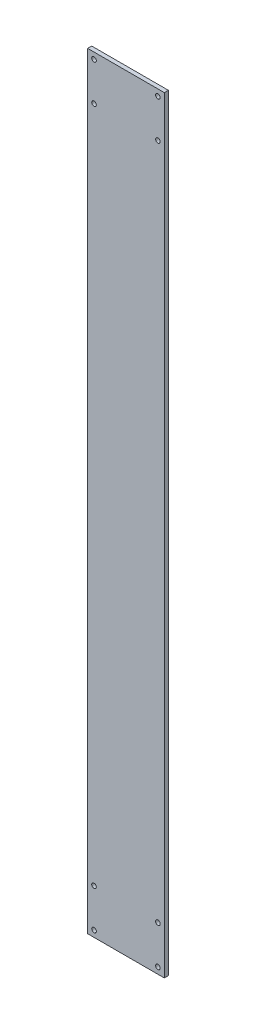
from build123d import *

# Parameters (mm, degrees)
SKETCH2_W                = 60
SKETCH2_H                = 600
BOSS_EXTRUDE1_DEPTH      = 3.175
M3_CLEARANCE_HOLE1_D     = 3.6
M3_CLEARANCE_HOLE1_DEPTH = 3.918450886
M3_CLEARANCE_HOLE1_TIP   = 1.081549114


with BuildPart() as part:
    # Sketch2 → Boss-Extrude1 (new body)
    with BuildSketch(Plane.XY):
        Rectangle(SKETCH2_W, SKETCH2_H)
    extrude(amount=BOSS_EXTRUDE1_DEPTH)

    # M3 Clearance Hole1
    with Locations(Plane.XY.offset(3.175)):
        with Locations((25, -295), (-25, -265), (-25, -295), (25, -265), (-25, 265), (-25, 295), (25, 295), (25, 265)):
            Hole(M3_CLEARANCE_HOLE1_D / 2, depth=M3_CLEARANCE_HOLE1_DEPTH)
            with Locations((0, 0, -(M3_CLEARANCE_HOLE1_DEPTH + M3_CLEARANCE_HOLE1_TIP / 2))):  # 118° drill point
                Cone(0, M3_CLEARANCE_HOLE1_D / 2, M3_CLEARANCE_HOLE1_TIP, mode=Mode.SUBTRACT)


solid = part.part
